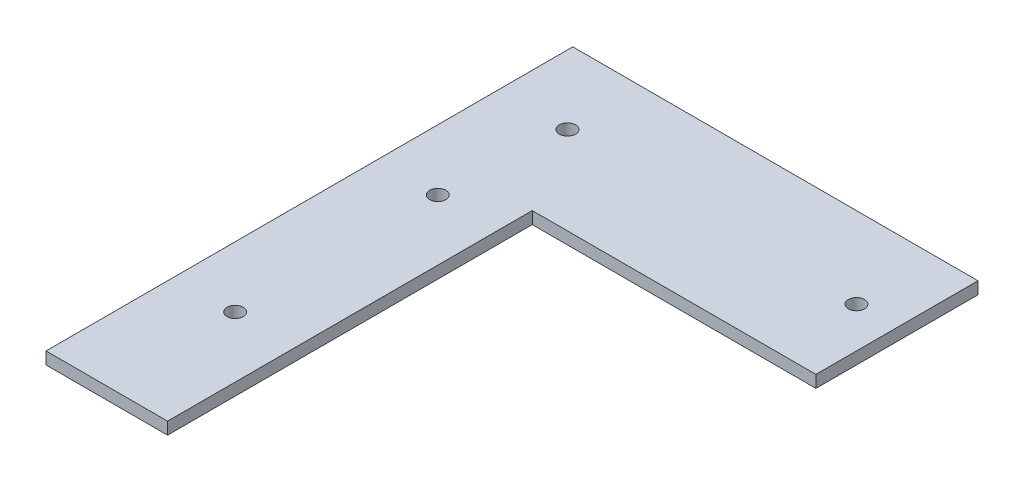
from build123d import *

# Parameters (mm, degrees)
SALIENTE_EXTRUIR1_DEPTH = 3
CROQUIS2_R              = 2
SALIENTE_EXTRUIR2_DEPTH = 3
CROQUIS3_R              = 2
CORTAR_EXTRUIR1_DEPTH   = 108.087875812


with BuildPart() as part:
    # Croquis1 → Saliente-Extruir1 (new body)
    with BuildSketch(Plane(origin=(0, 0, 0), x_dir=(1, 0, 0), z_dir=(0, 1, 0))):
        Polygon((-22.435530086, -36.676217765), (-52.435530086, -36.676217765), (-52.435530086, 93.323782235), (47.564469914, 93.323782235), (47.564469914, 53.323782235), (-22.435530086, 53.323782235), align=None)
    extrude(amount=SALIENTE_EXTRUIR1_DEPTH)

    # Croquis2 → Saliente-Extruir2 (add, through all)
    with BuildSketch(Plane(origin=(0, 3, 0), x_dir=(1, 0, 0), z_dir=(0, 1, 0))):
        with Locations((37.564469914, 73.323782235)):
            Circle(CROQUIS2_R)
        with Locations((-35.435530086, 75.002673531)):
            Circle(CROQUIS2_R)
        with Locations((-37.435530086, 45.002673531)):
            Circle(CROQUIS2_R)
        with Locations((-37.435530086, -4.997326469)):
            Circle(CROQUIS2_R)
    extrude(amount=-SALIENTE_EXTRUIR2_DEPTH)

    # Croquis3 → Cortar-Extruir1 (cut, through all)
    with BuildSketch(Plane(origin=(0, 3, 0), x_dir=(1, 0, 0), z_dir=(0, 1, 0))):
        with Locations(Location((37.564469914, 73.323782235, 0), (0, 0, 270))):
            Circle(CROQUIS3_R)
        with Locations(Location((-37.435530086, 45.002673531, 0), (0, 0, 270))):
            Circle(CROQUIS3_R)
        with Locations(Location((-37.435530086, -4.997326469, 0), (0, 0, 270))):
            Circle(CROQUIS3_R)
        with Locations(Location((-35.435530086, 75.002673531, 0), (0, 0, 270))):
            Circle(CROQUIS3_R)
    extrude(amount=-CORTAR_EXTRUIR1_DEPTH, mode=Mode.SUBTRACT)


solid = part.part
